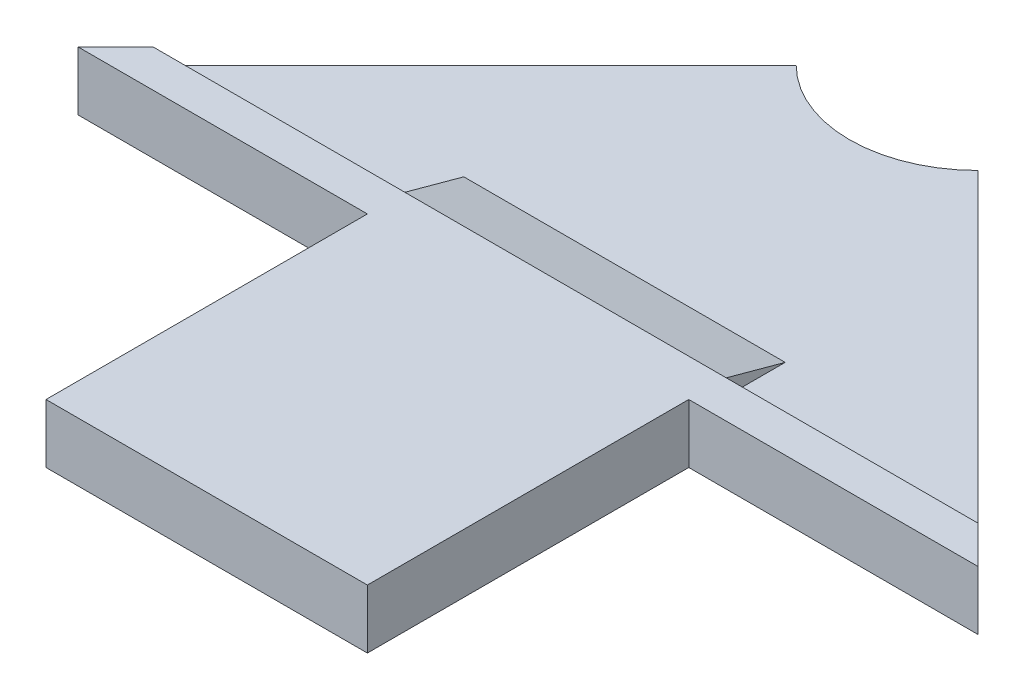
from build123d import *

# Parameters (mm, degrees)
BOSS_EXTRUDE1_DEPTH      = 139.7
BOSS_EXTRUDE2_DEPTH      = 101.6
BOSS_EXTRUDE4_DEPTH      = 381
BOSS_EXTRUDE4_DEPTH_BACK = 381


with BuildPart() as part:
    # Sketch1 → Boss-Extrude1 (new body)
    with BuildSketch(Plane(origin=(0, 0, 0), x_dir=(1, 0, 0), z_dir=(0, 1, 0))):
        Polygon((-977.9, -977.9), (-1066.8, -1066.8), (-381, -1066.8), (-381, -1828.8), (381, -1828.8), (381, -1066.8), (1066.8, -1066.8), (977.9, -977.9), align=None)
    extrude(amount=BOSS_EXTRUDE1_DEPTH)

    # Sketch1<10> → Boss-Extrude2 (add)
    with BuildSketch(Plane(origin=(0, 0, 0), x_dir=(1, 0, 0), z_dir=(0, 1, 0))):
        with BuildLine():
            Line((-977.9, -977.9), (977.9, -977.9))
            Line((977.9, -977.9), (215.526146906, -215.526146906))
            ThreePointArc((215.526146906, -215.526146906), (0, -304.8), (-215.526146906, -215.526146906))
            Line((-215.526146906, -215.526146906), (-977.9, -977.9))
        make_face()
    extrude(amount=BOSS_EXTRUDE2_DEPTH)

    # Sketch10 → Boss-Extrude4 (add, two sides: drawn at the far end of the back side and taken through both)
    with BuildSketch(Plane(origin=(0, 0, 0), x_dir=(0, 0, -1), z_dir=(1, 0, 0)).offset(-BOSS_EXTRUDE4_DEPTH_BACK)):
        Polygon((-977.9, 101.6), (-977.9, 139.7), (-838.2, 101.6), align=None)
    extrude(amount=BOSS_EXTRUDE4_DEPTH + BOSS_EXTRUDE4_DEPTH_BACK)


solid = part.part
